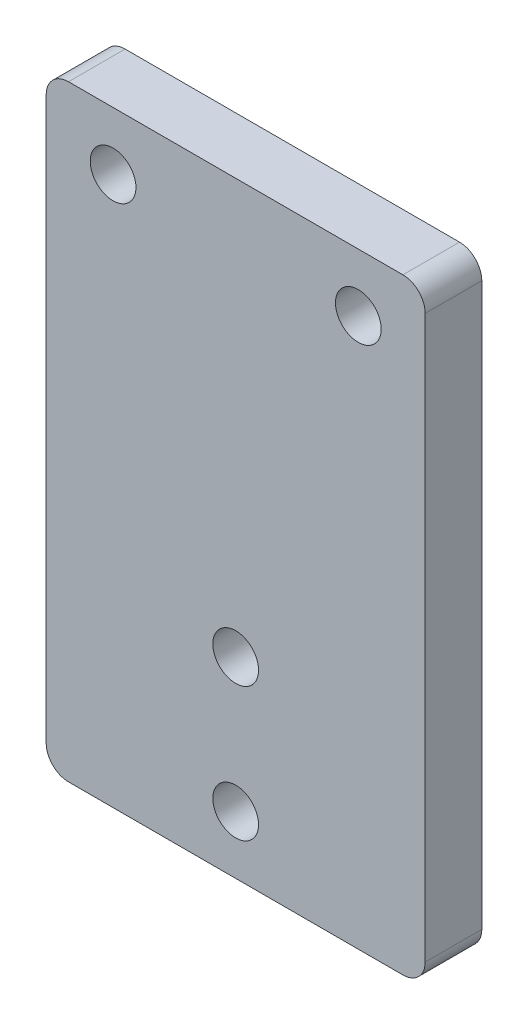
from build123d import *

# Parameters (mm, degrees)
CROQUIS1_R              = 5.125
SALIENTE_EXTRUIR1_DEPTH = 6.35


with BuildPart() as part:
    # Croquis1 → Saliente-Extruir1 (new, symmetric)
    with BuildSketch(Plane.XY):
        with BuildLine():
            Line((-37.5, 68), (37.5, 68))
            ThreePointArc((37.5, 68), (41.035533906, 66.535533906), (42.5, 63))
            Line((42.5, 63), (42.5, -63))
            ThreePointArc((42.5, -63), (41.035533906, -66.535533906), (37.5, -68))
            Line((37.5, -68), (-37.5, -68))
            ThreePointArc((-37.5, -68), (-41.035533906, -66.535533906), (-42.5, -63))
            Line((-42.5, -63), (-42.5, 63))
            ThreePointArc((-42.5, 63), (-41.035533906, 66.535533906), (-37.5, 68))
        make_face()
        with Locations((-27.5, 55)):
            Circle(CROQUIS1_R, mode=Mode.SUBTRACT)
        with Locations(Location((27.5, 55, 0), (0, 0, 180))):
            Circle(CROQUIS1_R, mode=Mode.SUBTRACT)
        with Locations((0, -55)):
            Circle(CROQUIS1_R, mode=Mode.SUBTRACT)
        with Locations((0, -25)):
            Circle(CROQUIS1_R, mode=Mode.SUBTRACT)
    extrude(amount=SALIENTE_EXTRUIR1_DEPTH, both=True)


solid = part.part
